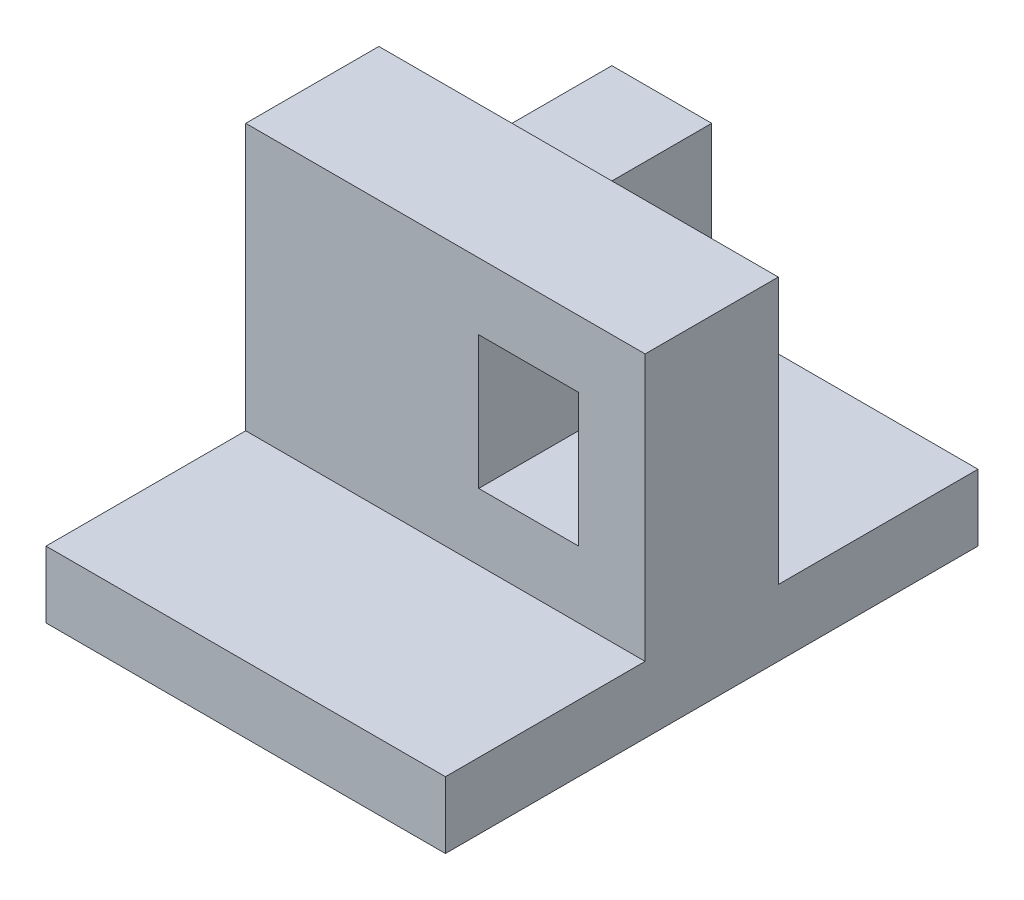
from build123d import *

# Parameters (mm, degrees)
BOSS_EXTRUDE2_DEPTH      = 30
BOSS_EXTRUDE2_DEPTH_BACK = 50
SKETCH1_W                = 60
SKETCH1_H                = 10
SKETCH1_4_W              = 60
SKETCH1_4_H              = 40
SKETCH1_4_W_2            = 15
SKETCH1_4_H_2            = 20
BOSS_EXTRUDE3_DEPTH      = 20
SKETCH1_5_W              = 15
SKETCH1_5_H              = 20
BOSS_EXTRUDE4_DEPTH      = 45


with BuildPart() as part:
    # Sketch1 → Boss-Extrude2 (new, two sides: drawn at the far end of the back side and taken through both)
    with BuildSketch(Plane.XY.offset(-BOSS_EXTRUDE2_DEPTH_BACK)):
        with Locations((-30, 5)):
            Rectangle(SKETCH1_W, SKETCH1_H)
    extrude(amount=BOSS_EXTRUDE2_DEPTH + BOSS_EXTRUDE2_DEPTH_BACK)

    # Sketch1<4> → Boss-Extrude3 (add)
    with BuildSketch(Plane.XY):
        with Locations((-30, 30)):
            Rectangle(SKETCH1_4_W, SKETCH1_4_H)
        with Locations((-42.5, 30)):
            Rectangle(SKETCH1_4_W_2, SKETCH1_4_H_2, mode=Mode.SUBTRACT)
        with Locations((-17.5, 30)):
            Rectangle(SKETCH1_4_W_2, SKETCH1_4_H_2, mode=Mode.SUBTRACT)
    extrude(amount=-BOSS_EXTRUDE3_DEPTH)

    # Sketch1<5> → Boss-Extrude4 (add)
    with BuildSketch(Plane.XY):
        with Locations((-42.5, 30)):
            Rectangle(SKETCH1_5_W, SKETCH1_5_H)
    extrude(amount=-BOSS_EXTRUDE4_DEPTH)


solid = part.part
